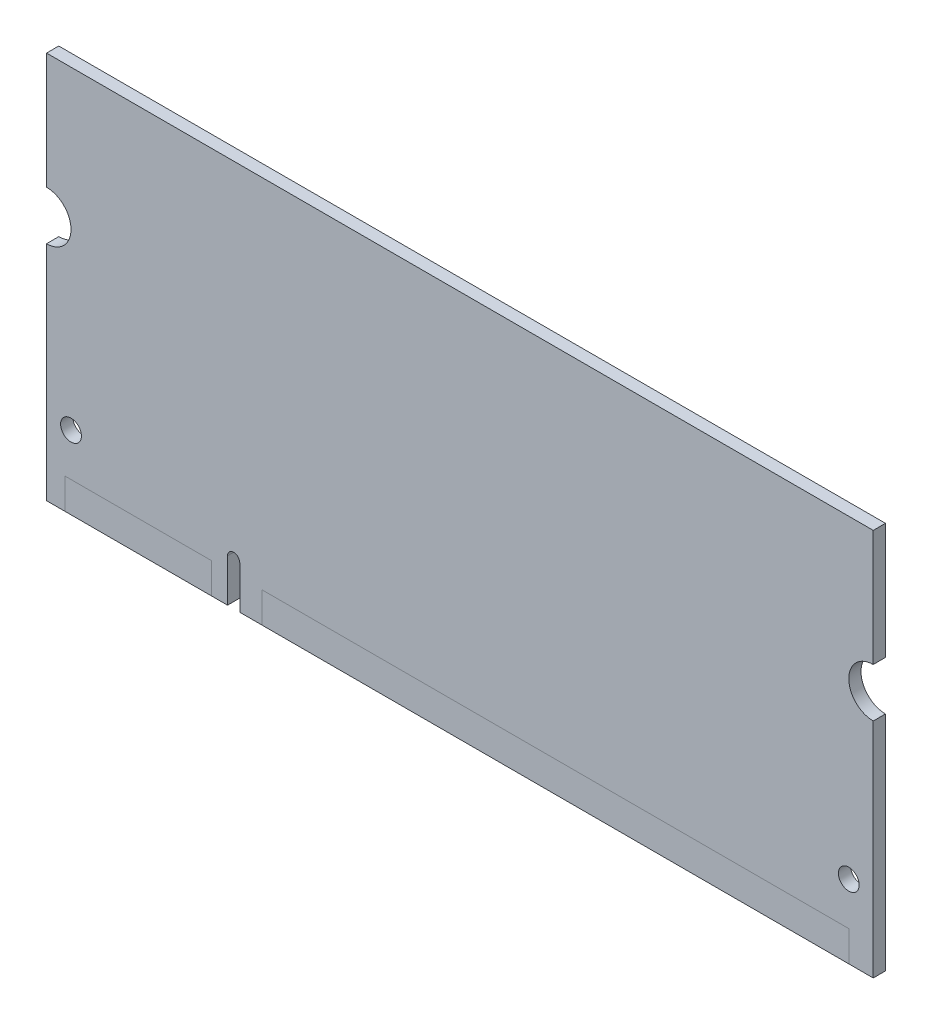
from build123d import *

# Parameters (mm, degrees)
SKETCH1_W                     = 67.6
SKETCH1_H                     = 31.7
MAIN_BOARD_DEPTH              = 0.5
MOUNTING_CLIP_GROOVES_DEPTH   = 38.345180412
M1_7_1_7_LOCATING_PIN_HOLES_D = 1.7
LOCATING_SLOT_DEPTH           = 38.345180412


with BuildPart() as part:
    # Sketch1 → MAIN BOARD (new, symmetric)
    with BuildSketch(Plane.XY):
        Rectangle(SKETCH1_W, SKETCH1_H)
    extrude(amount=MAIN_BOARD_DEPTH, both=True)

    # Sketch2 → MOUNTING CLIP GROOVES (cut, through all)
    with BuildSketch(Plane.XY.offset(0.5)):
        with BuildLine():
            Line((-33.8, 6.35), (-33.8, 2.35))
            ThreePointArc((-33.8, 2.35), (-31.8, 4.35), (-33.8, 6.35))
        make_face()
        with BuildLine():
            Line((33.8, 6.35), (33.8, 2.35))
            ThreePointArc((33.8, 2.35), (31.8, 4.35), (33.8, 6.35))
        make_face()
    extrude(amount=-MOUNTING_CLIP_GROOVES_DEPTH, mode=Mode.SUBTRACT)

    # M1.7 (1.7) LOCATING PIN HOLES (through all)
    with Locations(Plane.XY.offset(0.5)):
        with Locations((-31.8, -9.85), (31.8, -9.85)):
            Hole(M1_7_1_7_LOCATING_PIN_HOLES_D / 2)

    # Sketch5 → LOCATING SLOT (cut, through all)
    with BuildSketch(Plane.XY.offset(0.5)):
        with BuildLine():
            Line((-19, -15.85), (-19, -12.35))
            ThreePointArc((-19, -12.35), (-18.5, -11.85), (-18, -12.35))
            Line((-18, -12.35), (-18, -15.85))
            Line((-18, -15.85), (-19, -15.85))
        make_face()
    extrude(amount=-LOCATING_SLOT_DEPTH, mode=Mode.SUBTRACT)


solid = part.part
